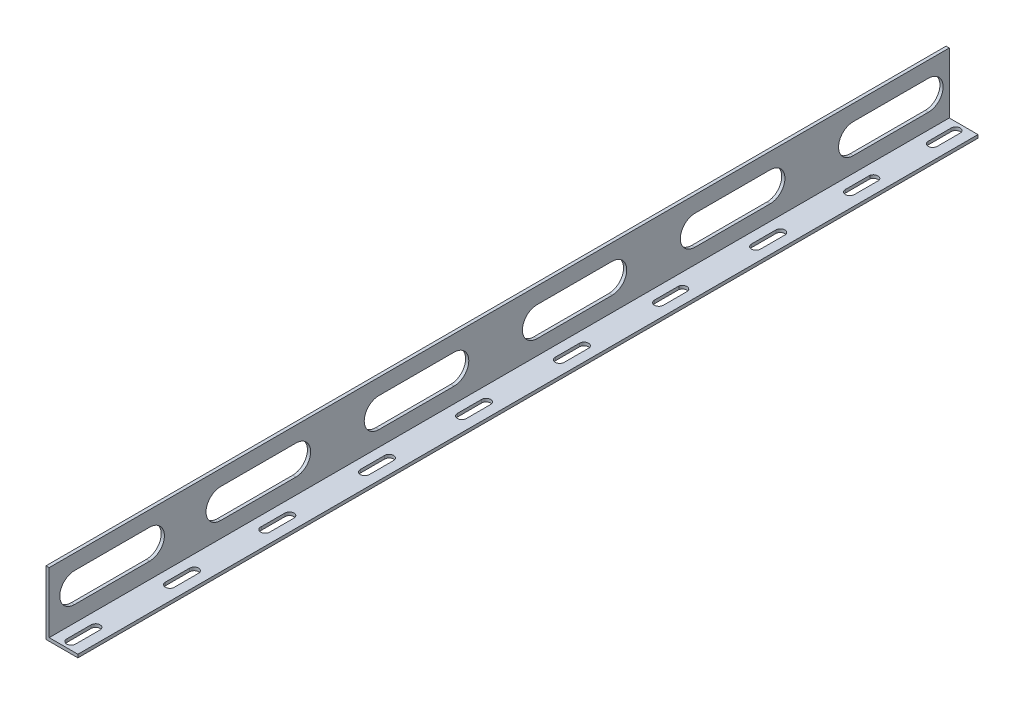
from build123d import *

# Parameters (mm, degrees)
BOSS_EXTRUDE1_DEPTH = 705
CUT_EXTRUDE2_DEPTH  = 10
CUT_EXTRUDE3_DEPTH  = 10


with BuildPart() as part:
    # Sketch1 → Boss-Extrude1 (new body)
    with BuildSketch(Plane.XY):
        Polygon((-9.451520251, 23.80952381), (-9.451520251, -26.19047619), (15.548479749, -26.19047619), (15.548479749, -23.69047619), (-6.951520251, -23.69047619), (-6.951520251, 23.80952381), align=None)
    extrude(amount=BOSS_EXTRUDE1_DEPTH)

    # Sketch3 → Cut-Extrude2 (cut)
    with BuildSketch(Plane(origin=(0, -23.69047619, 0), x_dir=(1, 0, 0), z_dir=(0, 1, 0))):
        with BuildLine():
            Line((1.100010518, -238.921557585), (1.100010518, -219.921557585))
            ThreePointArc((1.100010518, -219.921557585), (4.600010518, -217.057732255), (8.100010518, -219.921557585))
            Line((8.100010518, -219.921557585), (8.100010518, -238.921557585))
            ThreePointArc((8.100010518, -238.921557585), (4.600010518, -242.50349619), (1.100010518, -238.921557585))
        make_face()
        with BuildLine():
            Line((1.062751019, -162.814659823), (1.06366359, -143.814659845))
            ThreePointArc((1.06366359, -143.814659845), (4.564952106, -140.315948836), (8.063663115, -143.817237352))
            Line((8.063663115, -143.817237352), (8.064681771, -162.817237325))
            ThreePointArc((8.064681771, -162.817237325), (4.562374007, -166.462622847), (1.062751019, -162.814659823))
        make_face()
        with BuildLine():
            Line((0.583868221, -24.003598612), (0.583868221, -6.003598612))
            ThreePointArc((0.583868221, -6.003598612), (4.083868221, -2.503598612), (7.583868221, -6.003598612))
            Line((7.583868221, -6.003598612), (7.583868221, -24.003598612))
            ThreePointArc((7.583868221, -24.003598612), (4.083868221, -27.503598612), (0.583868221, -24.003598612))
        make_face()
        with BuildLine():
            Line((0.999318179, -316.46999614), (0.999318179, -297.46999614))
            ThreePointArc((0.999318179, -297.46999614), (4.499318179, -294.01841185), (7.999318179, -297.46999614))
            Line((7.999318179, -297.46999614), (7.999318179, -316.46999614))
            ThreePointArc((7.999318179, -316.46999614), (4.499318179, -320.051934745), (0.999318179, -316.46999614))
        make_face()
        with BuildLine():
            Line((0.793870885, -392.945206895), (0.793870885, -373.945206895))
            ThreePointArc((0.793870885, -373.945206895), (4.293870885, -370.493622604), (7.793870885, -373.945206895))
            Line((7.793870885, -373.945206895), (7.793870885, -392.945206895))
            ThreePointArc((7.793870885, -392.945206895), (4.293870885, -396.527145499), (0.793870885, -392.945206895))
        make_face()
        with BuildLine():
            Line((0.80674983, -468.976356015), (0.80674983, -449.976356015))
            ThreePointArc((0.80674983, -449.976356015), (4.30674983, -446.524771725), (7.80674983, -449.976356015))
            Line((7.80674983, -449.976356015), (7.80674983, -468.976356015))
            ThreePointArc((7.80674983, -468.976356015), (4.30674983, -472.55829462), (0.80674983, -468.976356015))
        make_face()
        with BuildLine():
            Line((0.838773895, -546.576842351), (0.838773895, -528.023898071))
            ThreePointArc((0.838773895, -528.023898071), (4.338773895, -524.572313781), (7.838773895, -528.023898071))
            Line((7.838773895, -528.023898071), (7.838773895, -546.576842351))
            ThreePointArc((7.838773895, -546.576842351), (4.338773895, -550.644510243), (0.838773895, -546.576842351))
        make_face()
        with BuildLine():
            Line((0.888336666, -621.781220279), (0.888336666, -602.781220279))
            ThreePointArc((0.888336666, -602.781220279), (4.388336666, -599.329635989), (7.888336666, -602.781220279))
            Line((7.888336666, -602.781220279), (7.888336666, -621.781220279))
            ThreePointArc((7.888336666, -621.781220279), (4.388336666, -625.363158884), (0.888336666, -621.781220279))
        make_face()
        with BuildLine():
            Line((0.754778841, -698.918998588), (0.754778841, -679.918998588))
            ThreePointArc((0.754778841, -679.918998588), (4.254778841, -676.361761205), (7.754778841, -679.918998588))
            Line((7.754778841, -679.918998588), (7.754778841, -698.918998588))
            ThreePointArc((7.754778841, -698.918998588), (4.254778841, -702.500937193), (0.754778841, -698.918998588))
        make_face()
        with BuildLine():
            Line((0.838792542, -89.065486865), (0.838792542, -70.065486865))
            ThreePointArc((0.838792542, -70.065486865), (4.338792542, -67.201661534), (7.838792542, -70.065486865))
            Line((7.838792542, -70.065486865), (7.838792542, -89.065486865))
            ThreePointArc((7.838792542, -89.065486865), (4.338792542, -92.647425469), (0.838792542, -89.065486865))
        make_face()
    extrude(amount=-CUT_EXTRUDE2_DEPTH, mode=Mode.SUBTRACT)

    # Sketch2 → Cut-Extrude3 (cut)
    with BuildSketch(Plane(origin=(-6.951520251, 0, 0), x_dir=(0, 0, -1), z_dir=(1, 0, 0))):
        with BuildLine():
            Line((-685.173208755, 11.86647277), (-626.275157977, 11.86647277))
            ThreePointArc((-626.275157977, 11.86647277), (-614.769492243, 0.360807036), (-626.275157977, -11.144858697))
            Line((-626.275157977, -11.144858697), (-685.173208755, -11.144858697))
            ThreePointArc((-685.173208755, -11.144858697), (-696.678874489, 0.360807036), (-685.173208755, 11.86647277))
        make_face()
        with BuildLine():
            Line((-570.642955191, 11.631729837), (-511.744904413, 11.631729837))
            ThreePointArc((-511.744904413, 11.631729837), (-500.239238679, 0.126064103), (-511.744904413, -11.379601631))
            Line((-511.744904413, -11.379601631), (-570.642955191, -11.379601631))
            ThreePointArc((-570.642955191, -11.379601631), (-582.148620925, 0.126064103), (-570.642955191, 11.631729837))
        make_face()
        with BuildLine():
            Line((-446.744904413, 11.34825395), (-387.846853634, 11.34825395))
            ThreePointArc((-387.846853634, 11.34825395), (-376.3411879, -0.157411783), (-387.846853634, -11.663077517))
            Line((-387.846853634, -11.663077517), (-446.744904413, -11.663077517))
            ThreePointArc((-446.744904413, -11.663077517), (-458.250570146, -0.157411783), (-446.744904413, 11.34825395))
        make_face()
        with BuildLine():
            Line((-322.846853634, 11.087774361), (-263.948802855, 11.087774361))
            ThreePointArc((-263.948802855, 11.087774361), (-252.615852555, -0.417891372), (-263.948802855, -11.923557106))
            Line((-263.948802855, -11.923557106), (-322.846853634, -11.923557106))
            ThreePointArc((-322.846853634, -11.923557106), (-334.352519367, -0.417891372), (-322.846853634, 11.087774361))
        make_face()
        with BuildLine():
            Line((-199.12283439, 11.260273997), (-140.224783611, 11.260273997))
            ThreePointArc((-140.224783611, 11.260273997), (-128.719117878, -0.245391736), (-140.224783611, -11.75105747))
            Line((-140.224783611, -11.75105747), (-199.12283439, -11.75105747))
            ThreePointArc((-199.12283439, -11.75105747), (-210.628500124, -0.245391736), (-199.12283439, 11.260273997))
        make_face()
        with BuildLine():
            Line((-75.224783611, 11.402162448), (-16.326732833, 11.402162448))
            ThreePointArc((-16.326732833, 11.402162448), (-4.821067099, -0.103503285), (-16.326732833, -11.609169019))
            Line((-16.326732833, -11.609169019), (-75.224783611, -11.609169019))
            ThreePointArc((-75.224783611, -11.609169019), (-86.730449345, -0.103503285), (-75.224783611, 11.402162448))
        make_face()
    extrude(amount=-CUT_EXTRUDE3_DEPTH, mode=Mode.SUBTRACT)


solid = part.part
